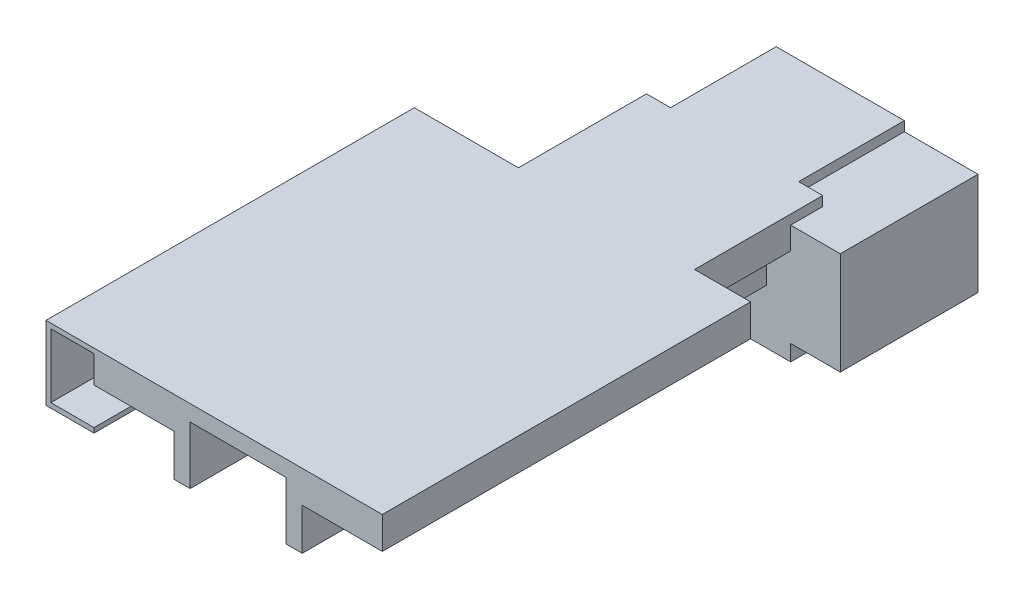
from build123d import *

# Parameters (mm, degrees)
BOSS_EXTRUDE1_DEPTH = 115
BOSS_EXTRUDE2_DEPTH = 30
SKETCH3_W           = 55
SKETCH3_H           = 40
BOSS_EXTRUDE3_DEPTH = 10
SKETCH4_W           = 40
SKETCH4_H           = 40
BOSS_EXTRUDE4_DEPTH = 33
BOSS_EXTRUDE5_START = -5
BOSS_EXTRUDE5_DEPTH = 32
BOSS_EXTRUDE6_DEPTH = 115


with BuildPart() as part:
    # Sketch1 → Boss-Extrude1 (new body)
    with BuildSketch(Plane.XY):
        Polygon((0, 0), (90, 0), (90, -10), (65, -10), (65, -23), (60, -23), (60, -5), (30, -5), (30, -23), (25, -23), (25, -10), (0, -10), align=None)
    extrude(amount=BOSS_EXTRUDE1_DEPTH)

    # Sketch2 → Boss-Extrude2 (add)
    with BuildSketch(Plane(origin=(0, 0, 0), x_dir=(-1, 0, 0), z_dir=(0, 0, -1))):
        Polygon((-17.5, -10), (-17.5, 0), (-72.5, 0), (-72.5, -10), (-65, -10), (-65, -23), (-60, -23), (-60, -5), (-30, -5), (-30, -23), (-25, -23), (-25, -10), align=None)
    extrude(amount=BOSS_EXTRUDE2_DEPTH)

    # Sketch3 → Boss-Extrude3 (add)
    with BuildSketch(Plane(origin=(0, 0, -30), x_dir=(-1, 0, 0), z_dir=(0, 0, -1))):
        with Locations((-45, -20)):
            Rectangle(SKETCH3_W, SKETCH3_H)
    extrude(amount=BOSS_EXTRUDE3_DEPTH)

    # Sketch4 → Boss-Extrude4 (add)
    with BuildSketch(Plane(origin=(0, 0, -40), x_dir=(-1, 0, 0), z_dir=(0, 0, -1))):
        with Locations((-45, -20)):
            Rectangle(SKETCH4_W, SKETCH4_H)
    extrude(amount=BOSS_EXTRUDE4_DEPTH)

    # Sketch5 → Boss-Extrude5 (add)
    with BuildSketch(Plane.XZ.offset(40).offset(BOSS_EXTRUDE5_START)):
        Polygon((65, -73), (65, -40), (72.5, -40), (72.5, -30), (88, -30), (88, -73), align=None)
    extrude(amount=-BOSS_EXTRUDE5_DEPTH)

    # Sketch7 → Boss-Extrude6 (add)
    with BuildSketch(Plane.XY.offset(115)):
        Polygon((0, 0), (-15, 0), (-15, -23), (0, -23), (0, -21.5), (-13.5, -21.5), (-13.5, -1.5), (0, -1.5), align=None)
    extrude(amount=-BOSS_EXTRUDE6_DEPTH)


solid = part.part
